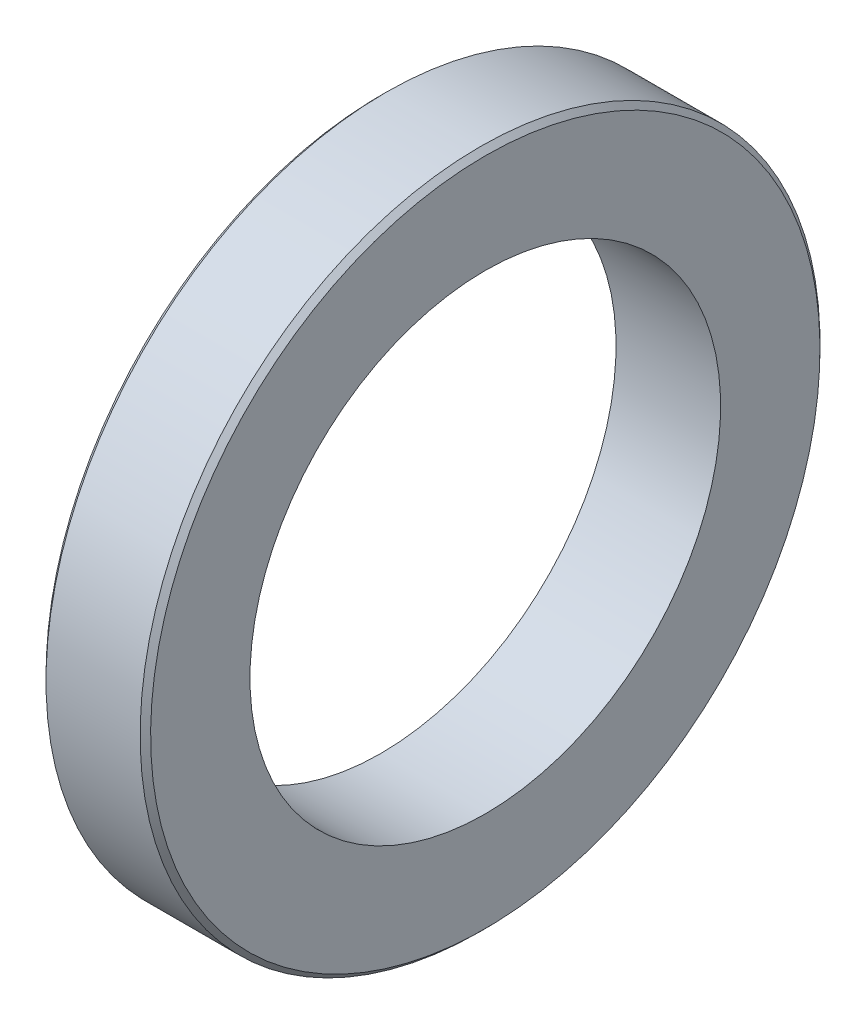
from build123d import *

# Parameters (mm, degrees)
SKETCH1_W     = 10
SKETCH1_H     = 10
CHAMFER1_SIZE = 0.5


with BuildPart() as part:
    # Sketch1 → Revolve1 (revolve)
    with BuildSketch(Plane.XY):
        with Locations((0, -27.5)):
            Rectangle(SKETCH1_W, SKETCH1_H)
    revolve(axis=Axis((-32.24824356, 0, 0), (1, 0, 0)))

    # Chamfer1
    chamfer1_edges = [part.edges().sort_by_distance(p)[0] for p in [
        (5, 32.5, 0),
        (-5, 32.5, 0),
    ]]
    chamfer(chamfer1_edges, length=CHAMFER1_SIZE)


solid = part.part
